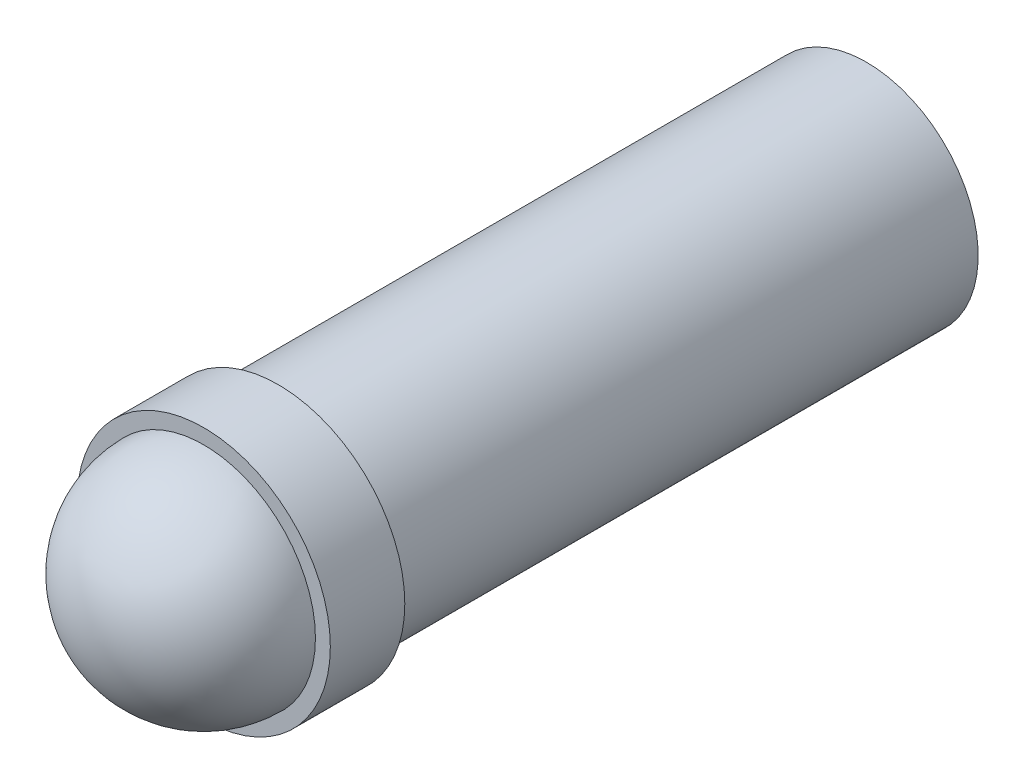
from build123d import *

# Parameters (mm, degrees)
SKETCH1_R           = 15
BOSS_EXTRUDE1_DEPTH = 104
FILLET1_R           = 15
BOSS_EXTRUDE2_START = 79
SKETCH2_R           = 17
SKETCH2_R_2         = 15
BOSS_EXTRUDE2_DEPTH = 10


with BuildPart() as part:
    # Sketch1 → Boss-Extrude1 (new body)
    with BuildSketch(Plane.XY):
        with Locations(Location((0, 0, 0), (0, 0, 180))):
            Circle(SKETCH1_R)
    extrude(amount=BOSS_EXTRUDE1_DEPTH)

    # Fillet1
    fillet1_edges = [part.edges().sort_by_distance(p)[0] for p in [
        (15, 0, 104),
    ]]
    fillet(fillet1_edges, radius=FILLET1_R)

    # Sketch2 → Boss-Extrude2 (add)
    with BuildSketch(Plane.XY.offset(BOSS_EXTRUDE2_START)):
        Circle(SKETCH2_R)
        with Locations(Location((0, 0, 0), (0, 0, 180))):
            Circle(SKETCH2_R_2, mode=Mode.SUBTRACT)
    extrude(amount=BOSS_EXTRUDE2_DEPTH)


solid = part.part
